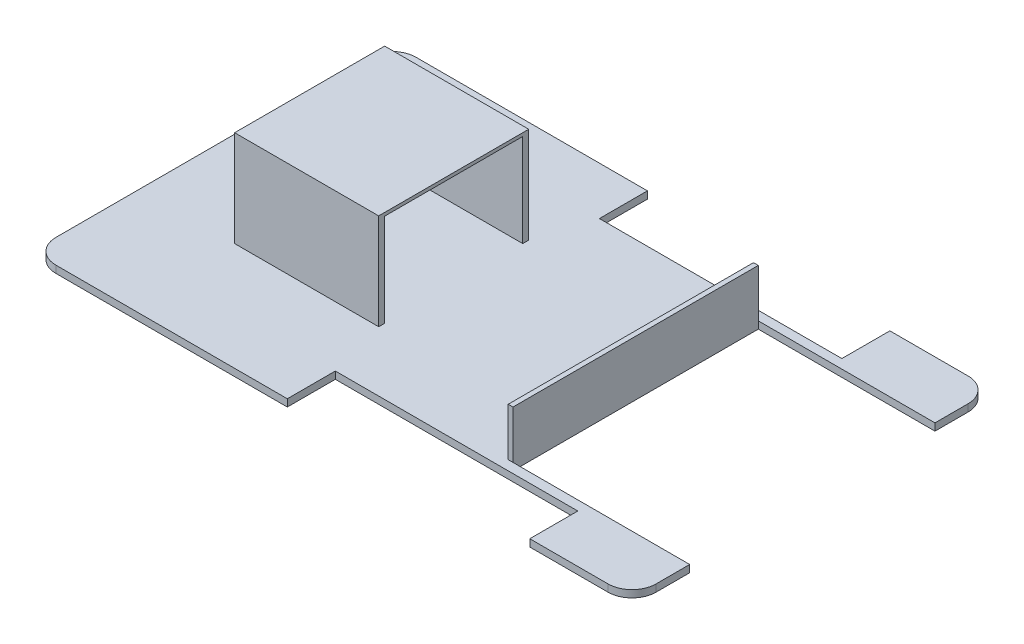
from build123d import *

# Parameters (mm, degrees)
BOSS_EXTRUDE1_DEPTH = 3
SKETCH2_W           = 60
SKETCH2_H           = 2.5
BOSS_EXTRUDE2_DEPTH = 40
SKETCH5_W           = 60
SKETCH5_H           = 1.359629359
BOSS_EXTRUDE5_DEPTH = 57.5
FILLET1_R           = 10
SKETCH6_W           = 2
SKETCH6_H           = 102.169483657
BOSS_EXTRUDE6_DEPTH = 20


with BuildPart() as part:
    # Sketch1 → Boss-Extrude1 (new body)
    with BuildSketch(Plane(origin=(0, 0, 0), x_dir=(1, 0, 0), z_dir=(0, 1, 0))):
        Polygon((106.407471576, 20), (207.407471576, 20), (207.407471576, 0), (250, 0), (250, 24.022028172), (176.397365129, 24.022028172), (176.397365129, 126.191511829), (250, 126.191511829), (250, 150), (207.407471576, 150), (207.407471576, 130), (106.407471576, 130), (106.407471576, 150), (0, 150), (0, 0), (106.407471576, 0), align=None)
    extrude(amount=BOSS_EXTRUDE1_DEPTH)

    # Sketch2 → Boss-Extrude2 (add)
    with BuildSketch(Plane(origin=(0, 3, 0), x_dir=(1, 0, 0), z_dir=(0, 1, 0))):
        with Locations((69.460984605, 106.25)):
            Rectangle(SKETCH2_W, SKETCH2_H)
        with Locations((69.460984605, 46.25)):
            Rectangle(SKETCH2_W, SKETCH2_H)
    extrude(amount=BOSS_EXTRUDE2_DEPTH)

    # Sketch5 → Boss-Extrude5 (add)
    with BuildSketch(Plane(origin=(0, 0, -47.5), x_dir=(-1, 0, 0), z_dir=(0, 0, -1))):
        with Locations((-69.460984605, 42.320185321)):
            Rectangle(SKETCH5_W, SKETCH5_H)
    extrude(amount=BOSS_EXTRUDE5_DEPTH)

    # Fillet1
    fillet1_edges = [part.edges().sort_by_distance(p)[0] for p in [
        (0, 1.5, -150),
        (250, 1.5, -150),
        (250, 1.5, 0),
        (0, 1.5, 0),
    ]]
    fillet(fillet1_edges, radius=FILLET1_R)

    # Sketch6 → Boss-Extrude6 (add)
    with BuildSketch(Plane(origin=(0, 3, 0), x_dir=(1, 0, 0), z_dir=(0, 1, 0))):
        with Locations((175.397365129, 75.106770001)):
            Rectangle(SKETCH6_W, SKETCH6_H)
    extrude(amount=BOSS_EXTRUDE6_DEPTH)


solid = part.part
